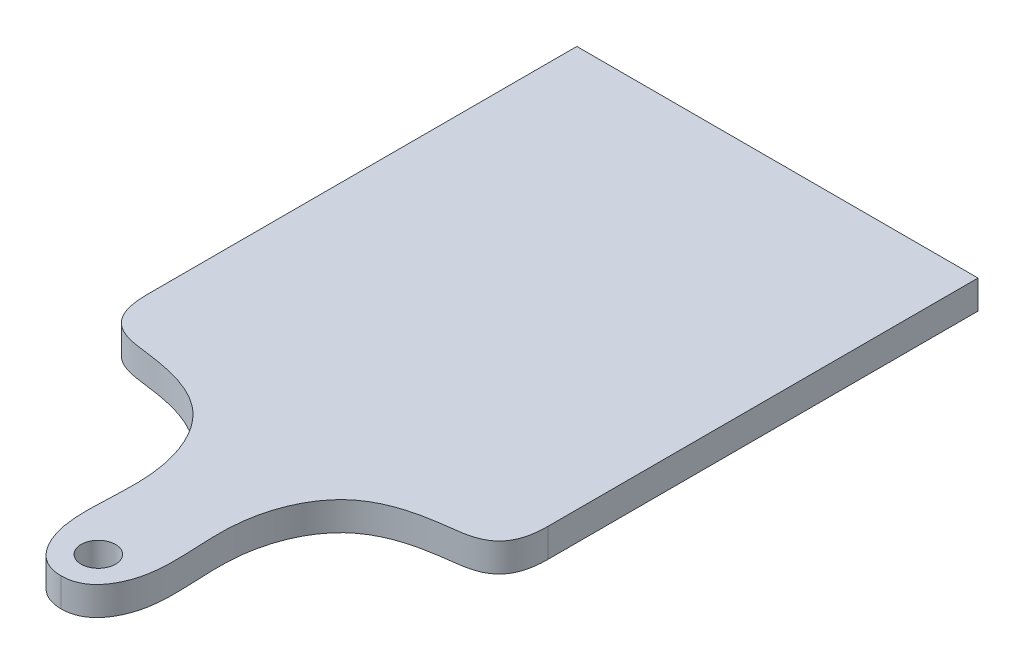
from build123d import *

# Parameters (mm, degrees)
SZKIC1_R                    = 6
DODANIE_WYCI_GNI_CIE1_DEPTH = 10


with BuildPart() as part:
    # Szkic1 → Dodanie-wyciągnięcie1 (new body)
    with BuildSketch(Plane(origin=(0, 0, 0), x_dir=(1, 0, 0), z_dir=(0, 1, 0))):
        with BuildLine():
            Line((-70, 100), (70, 100))
            Line((70, 100), (70, -50))
            add(Edge.make_bspline(
                [(70, -50), (70, -66.836628372), (50.096783844, -66.506768553), (23.166449086, -74.707127623), (10.787461156, -106.896749484), (19.278409827, -136.081374598), (6.228431212, -150), (0, -150)],
                knots=[0, 0, 0, 0, 0.201262298, 0.386001074, 0.607005142, 0.892124006, 1, 1, 1, 1], degree=3))
            add(Edge.make_bspline(
                [(-70, -50), (-70, -66.836628372), (-50.096783844, -66.506768553), (-23.166449086, -74.707127623), (-10.787461156, -106.896749484), (-19.278409827, -136.081374598), (-6.228431212, -150), (0, -150)],
                knots=[0, 0, 0, 0, 0.201262298, 0.386001074, 0.607005142, 0.892124006, 1, 1, 1, 1], degree=3))
            Line((-70, -50), (-70, 100))
        make_face()
        with Locations(Location((0, -137, 0), (0, 0, 270))):
            Circle(SZKIC1_R, mode=Mode.SUBTRACT)
    extrude(amount=DODANIE_WYCI_GNI_CIE1_DEPTH)


solid = part.part
